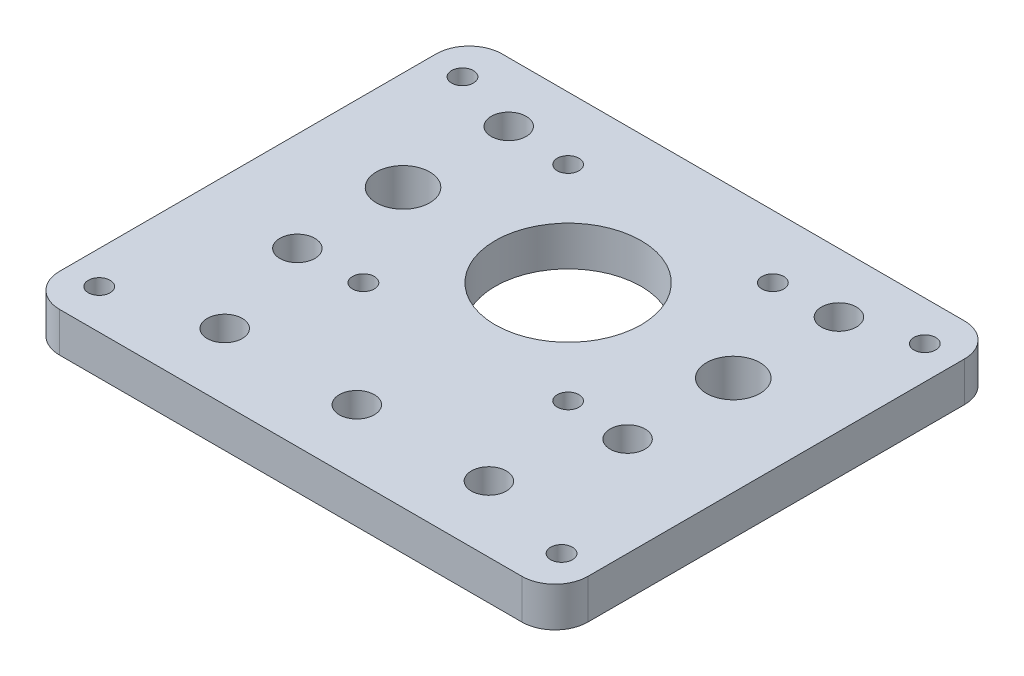
from build123d import *

# Parameters (mm, degrees)
SKETCH_1_R      = 11.05
SKETCH_1_R_2    = 1.65
SKETCH_1_R_3    = 4.05
SKETCH_1_R_4    = 2.65
EXTRUDE_1_DEPTH = 6
EXTRUDE_7_DEPTH = 1


with BuildPart() as part:
    # 草图1 → 凸台-拉伸1 (new body)
    with BuildSketch(Plane(origin=(0, 0, 0), x_dir=(1, 0, 0), z_dir=(0, 1, 0))):
        with BuildLine():
            Line((-40, 20), (-40, -37))
            ThreePointArc((-40, -37), (-38.535533906, -40.535533906), (-35, -42))
            Line((-35, -42), (35, -42))
            ThreePointArc((35, -42), (38.535533906, -40.535533906), (40, -37))
            Line((40, -37), (40, 20))
            ThreePointArc((40, 20), (38.535533906, 23.535533906), (35, 25))
            Line((35, 25), (-35, 25))
            ThreePointArc((-35, 25), (-38.535533906, 23.535533906), (-40, 20))
        make_face()
        with Locations(Location((0, 0, 0), (0, 0, 270))):
            Circle(SKETCH_1_R, mode=Mode.SUBTRACT)
        with Locations(Location((-15.5, 15.5, 0), (0, 0, 270))):
            Circle(SKETCH_1_R_2, mode=Mode.SUBTRACT)
        with Locations(Location((15.5, 15.5, 0), (0, 0, 270))):
            Circle(SKETCH_1_R_2, mode=Mode.SUBTRACT)
        with Locations(Location((15.5, -15.5, 0), (0, 0, 270))):
            Circle(SKETCH_1_R_2, mode=Mode.SUBTRACT)
        with Locations(Location((-15.5, -15.5, 0), (0, 0, 270))):
            Circle(SKETCH_1_R_2, mode=Mode.SUBTRACT)
        with Locations(Location((-25, 0, 0), (0, 0, 270))):
            Circle(SKETCH_1_R_3, mode=Mode.SUBTRACT)
        with Locations(Location((-25, 16, 0), (0, 0, 270))):
            Circle(SKETCH_1_R_4, mode=Mode.SUBTRACT)
        with Locations(Location((-25, -16, 0), (0, 0, 270))):
            Circle(SKETCH_1_R_4, mode=Mode.SUBTRACT)
        with Locations(Location((25, -16, 0), (0, 0, 270))):
            Circle(SKETCH_1_R_4, mode=Mode.SUBTRACT)
        with Locations(Location((25, 16, 0), (0, 0, 270))):
            Circle(SKETCH_1_R_4, mode=Mode.SUBTRACT)
        with Locations(Location((25, 0, 0), (0, 0, 270))):
            Circle(SKETCH_1_R_3, mode=Mode.SUBTRACT)
        with Locations(Location((-20, -32, 0), (0, 0, 270))):
            Circle(SKETCH_1_R_4, mode=Mode.SUBTRACT)
        with Locations(Location((0, -32, 0), (0, 0, 270))):
            Circle(SKETCH_1_R_4, mode=Mode.SUBTRACT)
        with Locations(Location((20, -32, 0), (0, 0, 270))):
            Circle(SKETCH_1_R_4, mode=Mode.SUBTRACT)
        with Locations(Location((-35, 19, 0), (0, 0, 270))):
            Circle(SKETCH_1_R_2, mode=Mode.SUBTRACT)
        with Locations(Location((-35, -36, 0), (0, 0, 270))):
            Circle(SKETCH_1_R_2, mode=Mode.SUBTRACT)
        with Locations(Location((35, -36, 0), (0, 0, 270))):
            Circle(SKETCH_1_R_2, mode=Mode.SUBTRACT)
        with Locations(Location((35, 19, 0), (0, 0, 270))):
            Circle(SKETCH_1_R_2, mode=Mode.SUBTRACT)
    extrude(amount=EXTRUDE_1_DEPTH)

    # 草图4 → 凸台-拉伸7 (add)
    with BuildSketch(Plane(origin=(0, 0, 0), x_dir=(1, 0, 0), z_dir=(0, 1, 0))):
        with BuildLine():
            Line((24.304735338, -39.311206095), (24.71939547, -37.4452355))
            add(Edge.make_bspline(
                [(24.71939547, -37.4452355), (24.724485002, -37.423325957), (24.733872504, -37.382914408), (24.748509601, -37.328219699), (24.75912958, -37.283680778), (24.772731003, -37.238371434), (24.78743879, -37.186162298), (24.810580824, -37.127996466), (24.830482164, -37.075113262), (24.84363471, -37.043230904), (24.849163209, -37.029829576)],
                knots=[0, 0, 0, 0, 1.238322188, 2.284051206, 3.117304464, 3.758429334, 4.888539964, 6.101256058, 7.201888128, 8, 8, 8, 8], degree=3))
            Line((24.849163209, -37.029829576), (24.887944372, -36.944809333))
            Line((24.887944372, -36.944809333), (24.820077336, -36.842635884))
            Line((24.820077336, -36.842635884), (24.447927326, -37.063390199))
            add(Edge.make_bspline(
                [(24.447927326, -37.063390199), (24.451260791, -37.083999464), (24.457030529, -37.119671066), (24.463689723, -37.168891422), (24.463675494, -37.214054309), (24.463082367, -37.254153419), (24.458985287, -37.293669635), (24.45348411, -37.332916372), (24.446324478, -37.380999377), (24.439617877, -37.415925632), (24.43599466, -37.434794418)],
                knots=[0, 0, 0, 0, 1.338411387, 2.316592945, 3.17702585, 4.228968444, 4.885249272, 5.721144607, 6.768856447, 8, 8, 8, 8], degree=3))
            Line((24.43599466, -37.434794418), (24.180933931, -38.996482037))
            Line((24.180933931, -38.996482037), (23.893804164, -37.423607543))
            add(Edge.make_bspline(
                [(23.893804164, -37.423607543), (23.887720737, -37.395829965), (23.875181162, -37.338572919), (23.863293448, -37.250920625), (23.851558231, -37.16527791), (23.846388561, -37.097730016), (23.842968475, -37.050235005), (23.842062518, -37.021850897), (23.839799514, -36.999528944), (23.840014538, -36.986825603), (23.840107168, -36.981353122)],
                knots=[0, 0, 0, 0, 1.529030851, 3.151743129, 4.755722009, 6.178359585, 6.794824103, 7.317056175, 7.705794154, 8, 8, 8, 8], degree=3))
            Line((23.840107168, -36.981353122), (23.845327709, -36.879925464))
            Line((23.845327709, -36.879925464), (23.693932014, -36.827720051))
            Line((23.693932014, -36.827720051), (23.499280405, -37.212548519))
            add(Edge.make_bspline(
                [(23.499280405, -37.212548519), (23.505285473, -37.222219818), (23.516350723, -37.240040653), (23.530774922, -37.264460485), (23.543057444, -37.283381368), (23.555478039, -37.302591045), (23.568422451, -37.32726215), (23.582098256, -37.35569548), (23.594510894, -37.389393423), (23.605914232, -37.430627655), (23.619996609, -37.486901202), (23.630097525, -37.529495953), (23.635760268, -37.553375283)],
                knots=[0, 0, 0, 0, 0.921907577, 1.698754621, 2.296307198, 2.748718929, 3.550470391, 4.55020495, 5.30186169, 6.455026243, 8.012628348, 10, 10, 10, 10], degree=3))
            Line((23.635760268, -37.553375283), (23.970620699, -38.986786747))
            add(Edge.make_bspline(
                [(23.970620699, -38.986786747), (23.971384868, -38.989267584), (23.974030853, -38.99785764), (23.97825569, -39.016533879), (23.983872525, -39.046782722), (23.993413477, -39.088327533), (24.003260834, -39.141946473), (24.016132263, -39.206791389), (24.031090712, -39.28310279), (24.047459009, -39.367682356), (24.064655236, -39.453988767), (24.081611972, -39.535081625), (24.09827411, -39.607869505), (24.11343357, -39.672454781), (24.12911389, -39.728941175), (24.144875039, -39.776742105), (24.158491476, -39.816980819), (24.177360771, -39.858063114), (24.201979913, -39.901947598), (24.235779503, -39.9482524), (24.27302179, -39.989870364), (24.315525614, -40.025443825), (24.364047056, -40.055947368), (24.421977248, -40.075832606), (24.487755879, -40.090579156), (24.534842077, -40.09349028), (24.559796066, -40.095033071)],
                knots=[0, 0, 0, 0, 0.136147877, 0.471420703, 1.003374956, 1.750226953, 2.706735297, 3.862724125, 5.218194133, 6.785943471, 8.381806232, 9.834531584, 11.131596252, 12.298711875, 13.314372995, 14.205152041, 14.939373808, 15.540515836, 16.574101771, 17.573134416, 18.54244681, 19.495838758, 20.473188126, 21.52939635, 22.690669055, 24, 24, 24, 24], degree=3))
            add(Edge.make_bspline(
                [(24.559796066, -40.095033071), (24.586409955, -40.096411269), (24.639758325, -40.09917391), (24.70679784, -40.085491053), (24.7571366, -40.060609917), (24.793437447, -40.031632057), (24.826190126, -39.991598814), (24.856179038, -39.943044551), (24.881522311, -39.886751977), (24.89880027, -39.824595915), (24.91069442, -39.758136051), (24.911922127, -39.712249371), (24.912555495, -39.688576646)],
                knots=[0, 0, 0, 0, 1.286899443, 2.57963011, 3.251935945, 3.988213668, 4.80743426, 5.741876491, 6.74319247, 7.782291109, 8.855894274, 10, 10, 10, 10], degree=3))
            Line((24.912555495, -39.688576646), (24.922250786, -39.48124658))
            Line((24.922250786, -39.48124658), (24.734311302, -39.48124658))
            add(Edge.make_bspline(
                [(24.734311302, -39.48124658), (24.727618322, -39.50586278), (24.715164573, -39.55166659), (24.697649721, -39.614999293), (24.681167242, -39.66771811), (24.666119518, -39.710438937), (24.653080299, -39.744963884), (24.639188284, -39.771341438), (24.627077136, -39.791913261), (24.609893822, -39.811238836), (24.578561734, -39.822584558), (24.543738484, -39.823400822), (24.511465741, -39.816135454), (24.485621005, -39.802736912), (24.458957453, -39.784615831), (24.432355615, -39.759530325), (24.407145931, -39.725194904), (24.386893539, -39.67936529), (24.369872684, -39.622984593), (24.362439866, -39.581289528), (24.358432333, -39.558808907)],
                knots=[0, 0, 0, 0, 1.79404273, 3.338207843, 4.621043795, 5.677144978, 6.524489655, 7.212578166, 7.770396117, 8.203257492, 9.002141715, 10.016764564, 10.627423213, 11.307693552, 12.049644943, 12.890653229, 13.866266954, 15.023854564, 16.3953594, 18, 18, 18, 18], degree=3))
            Line((24.358432333, -39.558808907), (24.233139344, -39.306731345))
            Line((24.233139344, -39.306731345), (24.304735338, -39.311206095))
        make_face()
        with BuildLine():
            Line((25.825404419, -37.963560665), (25.34213146, -38.930852376))
            add(Edge.make_bspline(
                [(25.34213146, -38.930852376), (25.33049394, -38.955237797), (25.308944204, -39.000393412), (25.278397315, -39.062683831), (25.25184266, -39.113581959), (25.229321882, -39.15468831), (25.209895884, -39.189052181), (25.200075696, -39.222963887), (25.194071013, -39.255775268), (25.195098347, -39.287110209), (25.200152336, -39.314948454), (25.207864919, -39.338171788), (25.219980288, -39.355598697), (25.240227909, -39.369180442), (25.26728082, -39.376416106), (25.288659778, -39.377204716), (25.298875546, -39.377581547)],
                knots=[0, 0, 0, 0, 2.078763659, 3.849343132, 5.337860138, 6.493364119, 7.459938902, 8.361301002, 9.194546773, 10.017188772, 10.756206604, 11.367342629, 11.887627112, 12.354553205, 13.213736046, 14, 14, 14, 14], degree=3))
            add(Edge.make_bspline(
                [(25.298875546, -39.377581547), (25.306411417, -39.377271394), (25.321466561, -39.37665177), (25.344500584, -39.367133023), (25.368448867, -39.348307647), (25.386170791, -39.333858402), (25.396574247, -39.325376135)],
                knots=[0, 0, 0, 0, 0.791936643, 1.582128931, 2.580615944, 4, 4, 4, 4], degree=3))
            Line((25.396574247, -39.325376135), (25.509188779, -39.241847475))
            add(Edge.make_bspline(
                [(25.509188779, -39.241847475), (25.526505152, -39.22965432), (25.556833721, -39.208298754), (25.59414639, -39.177837344), (25.619511226, -39.157074878), (25.634594153, -39.140015024), (25.63779983, -39.121752987), (25.642077444, -39.101116883), (25.643615071, -39.073537958), (25.64489235, -39.040227172), (25.647098275, -39.0016149), (25.655894462, -38.958944391), (25.669409, -38.912917298), (25.687219889, -38.865194268), (25.705994033, -38.818350047), (25.724189596, -38.775321996), (25.739187367, -38.737028496), (25.75020593, -38.714022172), (25.755300008, -38.703385937)],
                knots=[0, 0, 0, 0, 1.645052863, 2.881209681, 3.72933552, 4.211973671, 4.591267077, 5.140372713, 5.8570213, 6.726627572, 7.733480627, 8.854199255, 10.100564973, 11.456357308, 12.807882021, 14.01967868, 15.084462014, 16, 16, 16, 16], degree=3))
            Line((25.755300008, -38.703385937), (25.973071157, -38.173128106))
            Line((25.973071157, -38.173128106), (26.345221168, -39.041229534))
            Line((26.345221168, -39.041229534), (26.454852533, -39.255271724))
            add(Edge.make_bspline(
                [(26.454852533, -39.255271724), (26.466433442, -39.271495398), (26.491691689, -39.306879631), (26.534356225, -39.341393313), (26.569938017, -39.367467185), (26.595755769, -39.37627049), (26.618901052, -39.379871378), (26.642275219, -39.367246197), (26.662433399, -39.346287703), (26.676043723, -39.32103794), (26.680815719, -39.297712261), (26.681801805, -39.274924042), (26.681799606, -39.246554568), (26.680689676, -39.22568606), (26.680081598, -39.214253186)],
                knots=[0, 0, 0, 0, 1.782153251, 3.886920354, 4.902597257, 5.70769203, 6.334505672, 6.92401641, 7.997682522, 8.926431573, 9.452001144, 10.123367458, 10.971881293, 12, 12, 12, 12], degree=3))
            Line((26.680081598, -39.214253186), (26.670386307, -39.08597703))
            Line((26.670386307, -39.08597703), (26.655470475, -38.914444961))
            add(Edge.make_bspline(
                [(26.655470475, -38.914444961), (26.654253146, -38.902776573), (26.652068688, -38.881838016), (26.644901804, -38.850569004), (26.619131633, -38.824743559), (26.576987059, -38.810832456), (26.527701128, -38.783550821), (26.484292372, -38.730698044), (26.444414472, -38.659738572), (26.41892128, -38.605641767), (26.404884496, -38.575855572)],
                knots=[0, 0, 0, 0, 0.642751124, 1.153396727, 1.710076852, 2.535343349, 3.556724644, 4.738478284, 6.204176356, 8, 8, 8, 8], degree=3))
            Line((26.404884496, -38.575855572), (26.126704227, -37.987425997))
            Line((26.126704227, -37.987425997), (26.419054536, -37.375876881))
            add(Edge.make_bspline(
                [(26.419054536, -37.375876881), (26.432972449, -37.347288966), (26.458082472, -37.295712034), (26.491662016, -37.226823015), (26.519805875, -37.176155418), (26.545031329, -37.130165572), (26.574914314, -37.085810351), (26.611846516, -37.041487755), (26.643833313, -37.00432092), (26.663388324, -36.983060223), (26.671132099, -36.974640998)],
                knots=[0, 0, 0, 0, 1.601435843, 2.889232983, 3.858462789, 4.520012265, 5.530494073, 6.545310076, 7.42394354, 8, 8, 8, 8], degree=3))
            Line((26.671132099, -36.974640998), (26.729303844, -36.912740294))
            Line((26.729303844, -36.912740294), (26.684556348, -36.793413638))
            Line((26.684556348, -36.793413638), (26.275116757, -36.894095504))
            add(Edge.make_bspline(
                [(26.275116757, -36.894095504), (26.275239392, -36.912713836), (26.275437404, -36.942775671), (26.274450605, -36.982018421), (26.266227124, -37.012779651), (26.259043619, -37.041337984), (26.247146224, -37.075064658), (26.230448986, -37.117018665), (26.208105564, -37.175799853), (26.190872733, -37.220267231), (26.181147015, -37.24536335)],
                knots=[0, 0, 0, 0, 1.21816483, 1.966893151, 2.550031029, 3.290789217, 3.891750533, 4.884120903, 6.241486722, 8, 8, 8, 8], degree=3))
            Line((26.181147015, -37.24536335), (25.976054323, -37.776366972))
            Line((25.976054323, -37.776366972), (25.732180469, -37.16183469))
            add(Edge.make_bspline(
                [(25.732180469, -37.16183469), (25.725565876, -37.147370646), (25.713217049, -37.120367626), (25.694836554, -37.083893981), (25.68180324, -37.052548399), (25.665547122, -37.018188102), (25.647865111, -36.972487327), (25.631665584, -36.913468175), (25.616463652, -36.857464822), (25.610192597, -36.822040825), (25.607633271, -36.807583678)],
                knots=[0, 0, 0, 0, 1.012323175, 1.889912785, 2.598438302, 3.17202093, 4.309212077, 5.711164048, 7.065886393, 8, 8, 8, 8], degree=3))
            Line((25.607633271, -36.807583678), (25.601666938, -36.686765438))
            Line((25.601666938, -36.686765438), (25.418947995, -36.669612231))
            Line((25.418947995, -36.669612231), (25.321249295, -37.165563648))
            add(Edge.make_bspline(
                [(25.321249295, -37.165563648), (25.334907624, -37.170305892), (25.358513301, -37.178501906), (25.388520152, -37.188649271), (25.406871009, -37.195819256), (25.41748696, -37.19893585), (25.423357113, -37.203943044), (25.429636593, -37.211773185), (25.44068896, -37.222911009), (25.454598959, -37.238980448), (25.470204776, -37.260990733), (25.48793499, -37.288964782), (25.504889027, -37.324726371), (25.516921558, -37.350761513), (25.523358819, -37.364690007)],
                knots=[0, 0, 0, 0, 1.736427007, 3.001064989, 3.793959489, 4.11535666, 4.306432151, 4.707901453, 5.320187133, 6.187631058, 7.256088104, 8.556141407, 10.157576345, 12, 12, 12, 12], degree=3))
            Line((25.523358819, -37.364690007), (25.825404419, -37.963560665))
        make_face()
        with BuildLine():
            Line((28.085152981, -36.847856425), (27.884535039, -36.847856425))
            Line((27.884535039, -36.847856425), (27.605608979, -38.739929725))
            Line((27.605608979, -38.739929725), (27.376650957, -37.354994716))
            add(Edge.make_bspline(
                [(27.376650957, -37.354994716), (27.369100377, -37.320505375), (27.35508069, -37.256466614), (27.340454716, -37.166232656), (27.329804625, -37.089874591), (27.325074632, -37.043267662), (27.322953961, -37.02237166)],
                knots=[0, 0, 0, 0, 1.256363384, 2.332777349, 3.252508405, 4, 4, 4, 4], degree=3))
            Line((27.322953961, -37.02237166), (27.322953961, -36.913486086))
            Line((27.322953961, -36.913486086), (27.316241837, -36.806837887))
            Line((27.316241837, -36.806837887), (27.164846141, -36.763581974))
            Line((27.164846141, -36.763581974), (27.00151778, -37.145427275))
            add(Edge.make_bspline(
                [(27.00151778, -37.145427275), (27.00761906, -37.154455751), (27.018704608, -37.170859782), (27.035126259, -37.191868317), (27.045328898, -37.20953644), (27.055772891, -37.222067976), (27.063142743, -37.237104885), (27.071323116, -37.257198598), (27.079697977, -37.285187486), (27.090582458, -37.317777792), (27.100092762, -37.351230438), (27.108377675, -37.380858362), (27.115111549, -37.40415375), (27.118631197, -37.417883284), (27.120098645, -37.423607543)],
                knots=[0, 0, 0, 0, 1.283274893, 2.331609754, 3.135583168, 3.680203769, 4.243396287, 5.097018049, 6.235891526, 7.680387388, 9.144336631, 10.33076792, 11.304046475, 12, 12, 12, 12], degree=3))
            Line((27.120098645, -37.423607543), (27.511639237, -39.294798679))
            Line((27.511639237, -39.294798679), (27.725681428, -39.294798679))
            Line((27.725681428, -39.294798679), (27.988945864, -37.49147458))
            Line((27.988945864, -37.49147458), (28.257430842, -39.294798679))
            Line((28.257430842, -39.294798679), (28.487134656, -39.294798679))
            Line((28.487134656, -39.294798679), (28.829453002, -37.375131089))
            add(Edge.make_bspline(
                [(28.829453002, -37.375131089), (28.836984226, -37.343077126), (28.851040964, -37.283249641), (28.869691353, -37.199074015), (28.885852461, -37.125355658), (28.905949041, -37.062702896), (28.923603866, -37.009002754), (28.935291782, -36.976608263), (28.940575951, -36.96196254)],
                knots=[0, 0, 0, 0, 1.383701415, 2.582625292, 3.62413832, 4.552797255, 5.345711924, 6, 6, 6, 6], degree=3))
            Line((28.940575951, -36.96196254), (28.968170241, -36.879179672))
            Line((28.968170241, -36.879179672), (28.904777954, -36.778497806))
            Line((28.904777954, -36.778497806), (28.563205399, -37.02237166))
            add(Edge.make_bspline(
                [(28.563205399, -37.02237166), (28.566131241, -37.04300157), (28.571026034, -37.07751443), (28.578433418, -37.125109681), (28.577953315, -37.172049168), (28.578465093, -37.229110256), (28.570527833, -37.300847723), (28.559939042, -37.352098749), (28.5542559, -37.379605839)],
                knots=[0, 0, 0, 0, 1.04221277, 1.743572458, 2.402350692, 3.384207066, 4.596070008, 6, 6, 6, 6], degree=3))
            Line((28.5542559, -37.379605839), (28.368553791, -38.749625016))
            Line((28.368553791, -38.749625016), (28.085152981, -36.847856425))
        make_face()
    extrude(amount=-EXTRUDE_7_DEPTH)


solid = part.part
